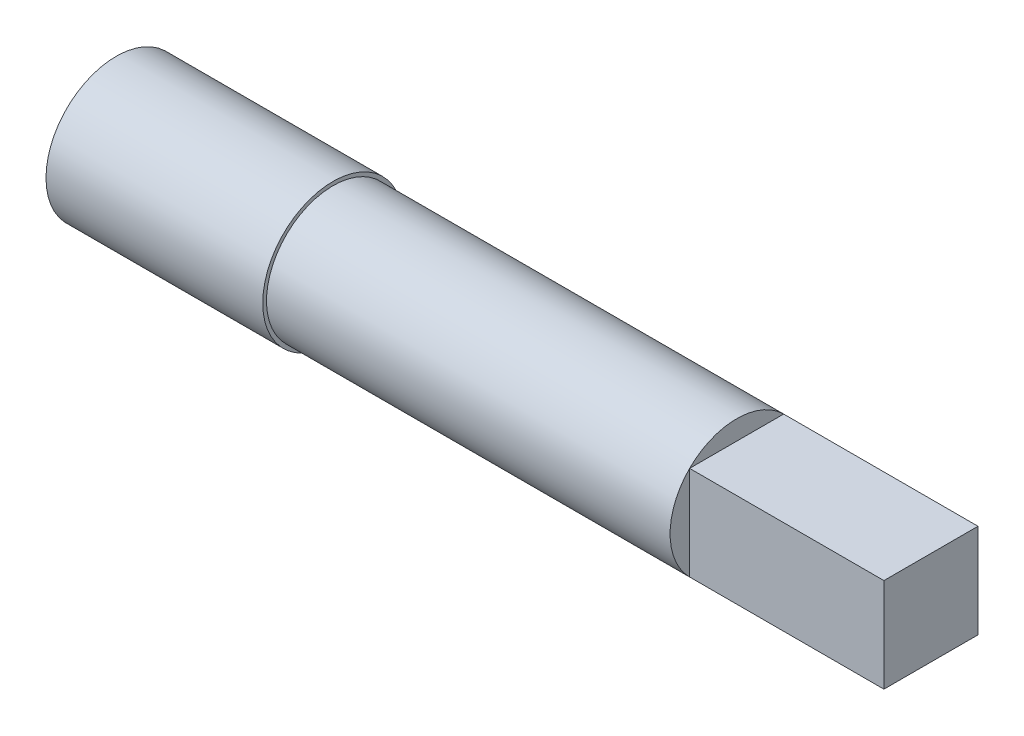
from build123d import *

# Parameters (mm, degrees)
CROQUIS1_R              = 2.35
CROQUIS1_R_2            = 2.225
SALIENTE_EXTRUIR1_DEPTH = 7.25
SALIENTE_EXTRUIR2_START = 7.25
CROQUIS1_3_R            = 2.225
SALIENTE_EXTRUIR2_DEPTH = 20
CORTAR_EXTRUIR1_START   = -6.5
CORTAR_EXTRUIR1_DEPTH   = 6.5


with BuildPart() as part:
    # Croquis1 → Saliente-Extruir1 (new body)
    # profile 1 of 2: a face of its own
    with BuildSketch(Plane.YZ):
        with Locations(Location((0, 0, 0), (0, 0, 90))):
            Circle(CROQUIS1_R)
        Circle(CROQUIS1_R_2, mode=Mode.SUBTRACT)
    # profile 2 of 2: a face of its own
    with BuildSketch(Plane.YZ):
        Circle(CROQUIS1_R_2)
    extrude(amount=SALIENTE_EXTRUIR1_DEPTH)

    # Croquis1<3> → Saliente-Extruir2 (add)
    with BuildSketch(Plane.YZ.offset(SALIENTE_EXTRUIR2_START)):
        with Locations(Location((0, 0, 0), (0, 0, 270))):
            Circle(CROQUIS1_3_R)
    extrude(amount=SALIENTE_EXTRUIR2_DEPTH)

    # Croquis3 → Cortar-Extruir1 (cut)
    with BuildSketch(Plane.YZ.offset(27.25).offset(CORTAR_EXTRUIR1_START)):
        with BuildLine():
            ThreePointArc((1.573312588, 1.573312588), (0, 2.225), (-1.573312588, 1.573312588))
            Line((-1.573312588, 1.573312588), (1.573312588, 1.573312588))
        make_face()
        with BuildLine():
            ThreePointArc((-1.573312588, 1.573312588), (-2.225, 0), (-1.573312588, -1.573312588))
            Line((-1.573312588, -1.573312588), (-1.573312588, 1.573312588))
        make_face()
        with BuildLine():
            Line((1.573312588, 1.573312588), (1.573312588, -1.573312588))
            ThreePointArc((1.573312588, -1.573312588), (2.05563196, -0.851470637), (2.225, 0))
            ThreePointArc((2.225, 0), (2.05563196, 0.851470637), (1.573312588, 1.573312588))
        make_face()
        with BuildLine():
            Line((1.573312588, -1.573312588), (-1.573312588, -1.573312588))
            ThreePointArc((-1.573312588, -1.573312588), (0, -2.225), (1.573312588, -1.573312588))
        make_face()
    extrude(amount=CORTAR_EXTRUIR1_DEPTH, mode=Mode.SUBTRACT)


solid = part.part
